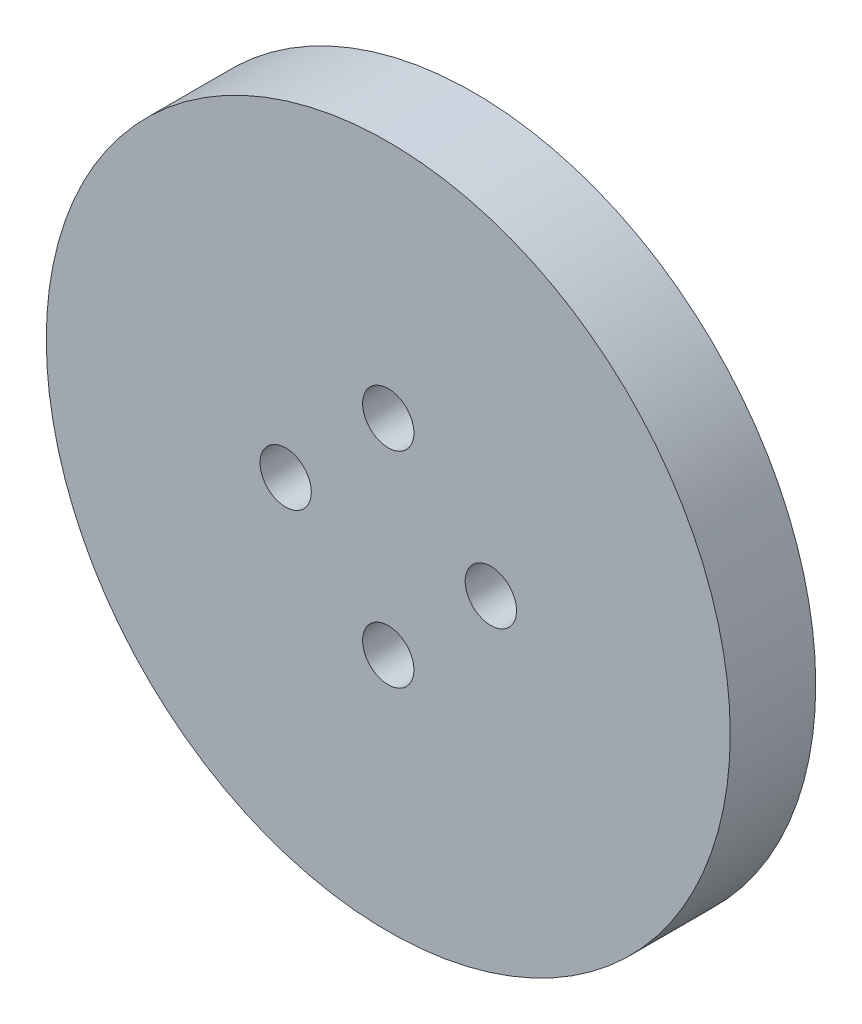
from build123d import *

# Parameters (mm, degrees)
SKETCH_1_R      = 17.5
SKETCH_1_R_2    = 3
EXTRUDE_1_DEPTH = 10
EXTRUDE_START   = -10
SKETCH_2_R      = 40
SKETCH_2_R_2    = 17.5
EXTRUDE_3_DEPTH = 10


with BuildPart() as part:
    # 草图1 → 凸台-拉伸1 (new body)
    with BuildSketch(Plane.XY):
        Circle(SKETCH_1_R)
        with Locations((-12, 0)):
            Circle(SKETCH_1_R_2, mode=Mode.SUBTRACT)
        with Locations((0, 12)):
            Circle(SKETCH_1_R_2, mode=Mode.SUBTRACT)
        with Locations((12, 0)):
            Circle(SKETCH_1_R_2, mode=Mode.SUBTRACT)
        with Locations((0, -12)):
            Circle(SKETCH_1_R_2, mode=Mode.SUBTRACT)
    extrude(amount=EXTRUDE_1_DEPTH)

    # 草图2 → 凸台-拉伸3 (add)
    with BuildSketch(Plane.XY.offset(10).offset(EXTRUDE_START)):
        Circle(SKETCH_2_R)
        Circle(SKETCH_2_R_2, mode=Mode.SUBTRACT)
    extrude(amount=EXTRUDE_3_DEPTH)


solid = part.part
